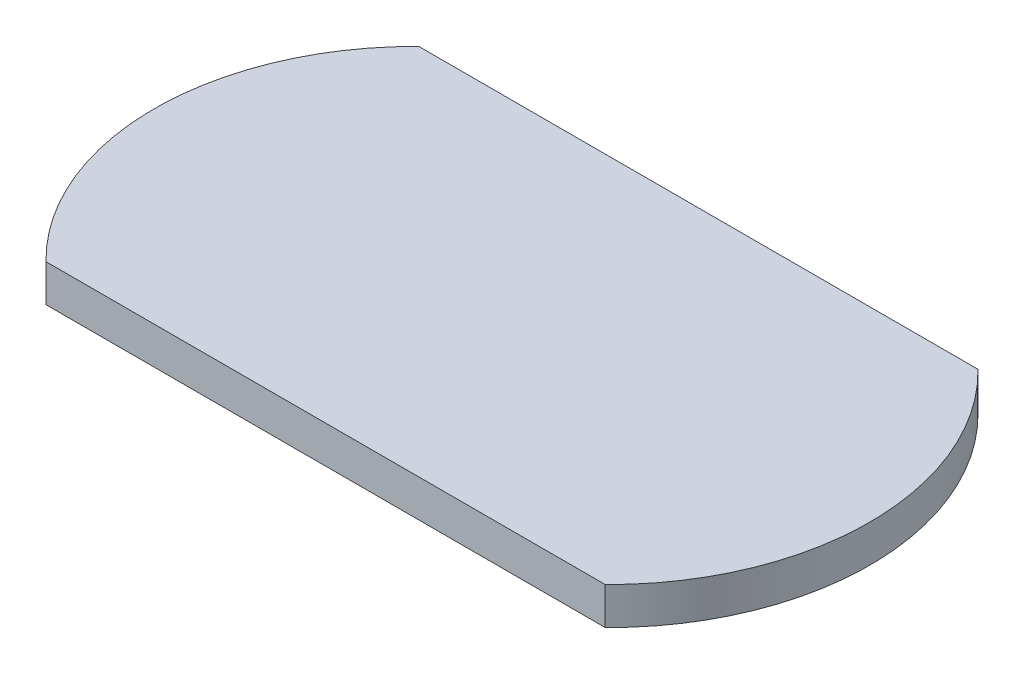
from build123d import *

# Parameters (mm, degrees)
SKETCH1_W           = 15
SKETCH1_H           = 10
BOSS_EXTRUDE1_DEPTH = 1


with BuildPart() as part:
    # Sketch1 → Boss-Extrude1 (new body)
    with BuildSketch(Plane(origin=(0, 0, 0), x_dir=(1, 0, 0), z_dir=(0, 1, 0))):
        with BuildLine():
            Line((-10.280932288, 5.550613066), (-10.280932288, -4.449386934))
            ThreePointArc((-10.280932288, -4.449386934), (-12.381952803, 0.550613066), (-10.280932288, 5.550613066))
        make_face()
        with Locations((-2.780932288, 0.550613066)):
            Rectangle(SKETCH1_W, SKETCH1_H)
        with BuildLine():
            ThreePointArc((4.719067712, 5.550613066), (6.820088226, 0.550613066), (4.719067712, -4.449386934))
            Line((4.719067712, -4.449386934), (4.719067712, 5.550613066))
        make_face()
    extrude(amount=BOSS_EXTRUDE1_DEPTH)


solid = part.part
